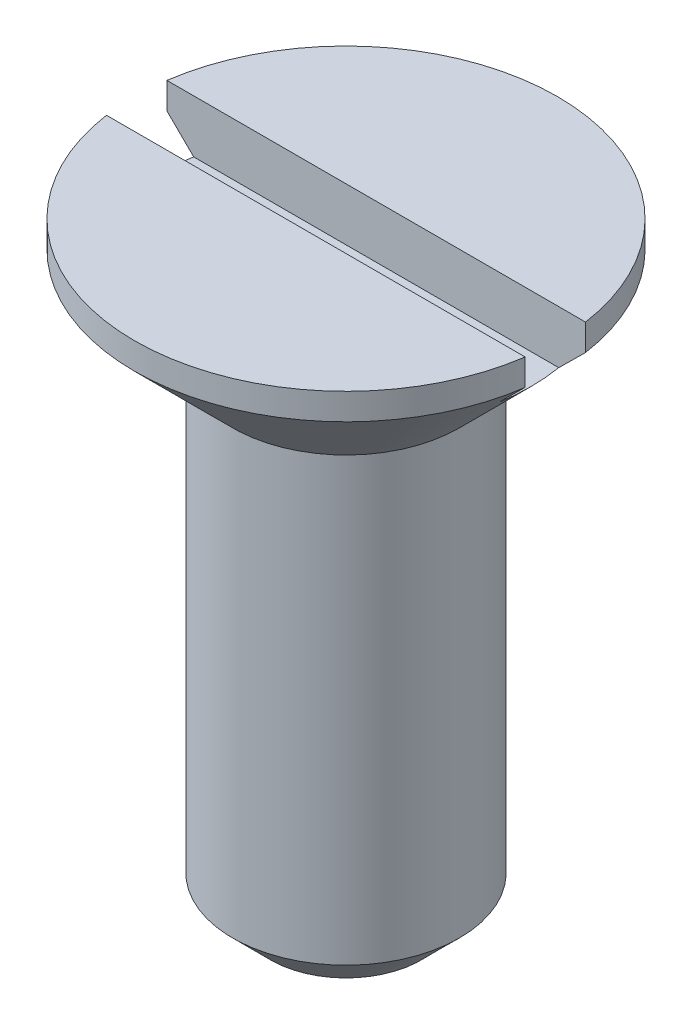
from build123d import *

# Parameters (mm, degrees)
SKETCH_13_W         = 5.6
SKETCH_13_H         = 0.8
CUT_EXTRUDE_9_DEPTH = 0.7
CHAMFER_1_SIZE      = 0.5


with BuildPart() as part:
    # Эскиз1 → Повернуть1 (revolve)
    with BuildSketch(Plane.XY):
        Polygon((0, 92.035042223), (0, 84.035042223), (1.5, 84.035042223), (1.5, 90.385042223), (2.8, 91.685042223), (2.8, 92.035042223), align=None)
    revolve(axis=Axis((0, 125.763182898, 0), (0, -1, 0)))

    # Эскиз13 → Вырез-Вытянуть9 (cut)
    with BuildSketch(Plane(origin=(0, 92.035042223, 0), x_dir=(-1, 0, 0), z_dir=(0, 1, 0))):
        Rectangle(SKETCH_13_W, SKETCH_13_H)
    extrude(amount=-CUT_EXTRUDE_9_DEPTH, mode=Mode.SUBTRACT)

    # Фаска1
    chamfer_1_edges = [part.edges().sort_by_distance(p)[0] for p in [
        (-1.5, 84.035042223, 0),
    ]]
    chamfer(chamfer_1_edges, length=CHAMFER_1_SIZE)


solid = part.part
